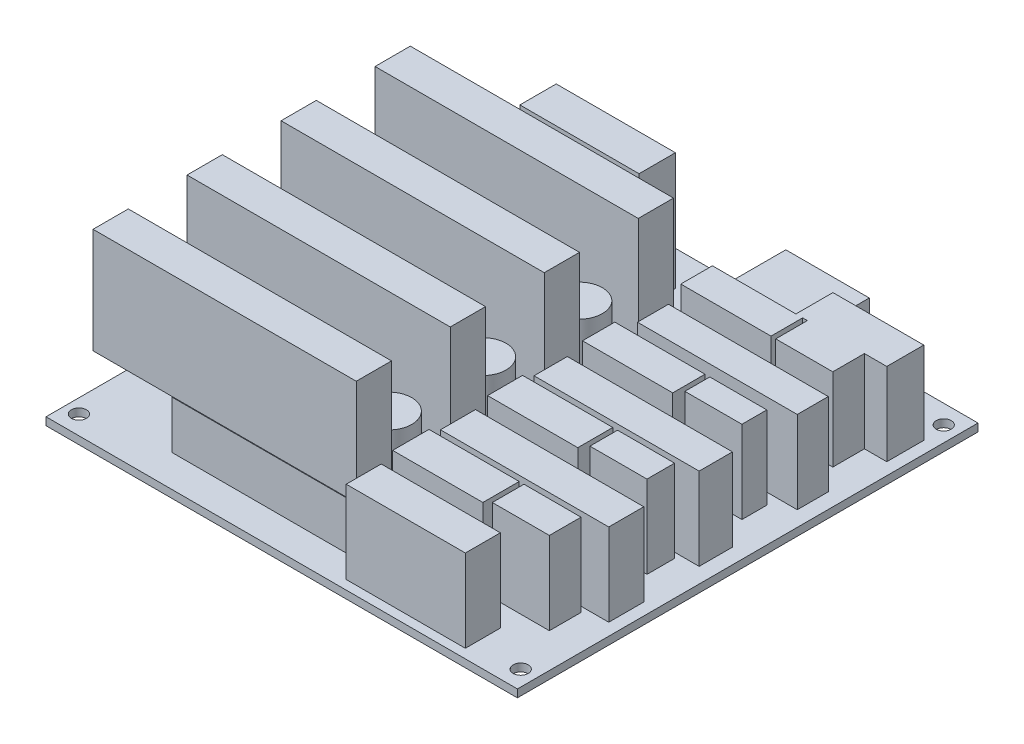
from build123d import *

# Parameters (mm, degrees)
SKETCH2_W            = 100.3
SKETCH2_H            = 98
BOSS_EXTRUDE1_DEPTH  = 1.65
SKETCH5_W            = 39.102680246
SKETCH5_H            = 7.304896309
SKETCH5_H_2          = 7.877829353
SKETCH5_H_3          = 8.164295876
SKETCH5_H_4          = 7.448129571
BOSS_EXTRUDE4_DEPTH  = 10.2
SKETCH5_3_R          = 4.932717276
BOSS_EXTRUDE5_DEPTH  = 17.65
M3_CLEARANCE_HOLE1_D = 3.2
SKETCH6_W            = 56
SKETCH6_H            = 7.5
BOSS_EXTRUDE6_DEPTH  = 22.4
LPATTERN1_COUNT      = 4
LPATTERN1_PITCH      = 20
SKETCH5_4_W          = 25.352287192
SKETCH5_4_H          = 7.44812957
SKETCH5_4_W_2        = 19.193256971
SKETCH5_4_H_2        = 7.734596093
SKETCH5_4_W_3        = 35.808315243
SKETCH5_4_W_4        = 35.131761676
SKETCH5_4_H_3        = 7.085146118
SKETCH5_4_H_4        = 6.875196527
SKETCH5_4_W_5        = 34.004867694
SKETCH5_4_H_5        = 6.601011751
SKETCH5_4_W_6        = 12.138008325
SKETCH5_4_H_6        = 5.299630656
SKETCH5_4_H_7        = 5.8725637
SKETCH5_4_H_8        = 6.731963266
BOSS_EXTRUDE11_DEPTH = 17.56
SKETCH5_6_W          = 17.760924361
SKETCH5_6_H          = 13.893626315
BOSS_EXTRUDE13_DEPTH = 12.7
SKETCH5_7_W          = 25.352287192
SKETCH5_7_H          = 7.734596093
BOSS_EXTRUDE14_DEPTH = 25


with BuildPart() as part:
    # Sketch2 → Boss-Extrude1 (new body)
    with BuildSketch(Plane(origin=(0, 0, 0), x_dir=(1, 0, 0), z_dir=(0, 1, 0))):
        Rectangle(SKETCH2_W, SKETCH2_H)
    extrude(amount=BOSS_EXTRUDE1_DEPTH)

    # Sketch5 → Boss-Extrude4 (add)
    with BuildSketch(Plane(origin=(0, 1.65, 0), x_dir=(1, 0, 0), z_dir=(0, 1, 0))):
        with Locations((-10.643944628, -38.524846902)):
            Rectangle(SKETCH5_W, SKETCH5_H)
        with Locations((-10.643944628, -18.042490583)):
            Rectangle(SKETCH5_W, SKETCH5_H_2)
        with Locations((-10.643944628, 2.010165954)):
            Rectangle(SKETCH5_W, SKETCH5_H_3)
        with Locations((-10.643944628, 21.704739338)):
            Rectangle(SKETCH5_W, SKETCH5_H_4)
    extrude(amount=BOSS_EXTRUDE4_DEPTH)

    # Sketch5<3> → Boss-Extrude5 (add)
    with BuildSketch(Plane(origin=(0, 1.65, 0), x_dir=(1, 0, 0), z_dir=(0, 1, 0))):
        with Locations((-7.9941293, 11.391944548)):
            Circle(SKETCH5_3_R)
        with BuildLine():
            ThreePointArc((-0.667240619, 7.976338656), (6.236323108, 8.047219973), (6.307204425, 14.9507837))
            ThreePointArc((6.307204425, 14.9507837), (-0.596359302, 14.879902383), (-0.667240619, 7.976338656))
        make_face()
        with Locations((-7.9941293, -9.090411772)):
            Circle(SKETCH5_3_R)
        with Locations((2.891598534, -9.090411772)):
            Circle(SKETCH5_3_R)
        with Locations((-7.9941293, -29.143068308)):
            Circle(SKETCH5_3_R)
        with Locations((2.891598534, -29.143068308)):
            Circle(SKETCH5_3_R)
    extrude(amount=BOSS_EXTRUDE5_DEPTH)

    # M3 Clearance Hole1 (through all)
    with Locations(Plane(origin=(0, 1.65, 0), x_dir=(1, 0, 0), z_dir=(0, 1, 0))):
        with Locations((46.85, -45), (46.85, 45), (-47.15, 45), (-47.15, -45)):
            Hole(M3_CLEARANCE_HOLE1_D / 2)

    # Sketch6 → Boss-Extrude6 (add)
    with BuildSketch(Plane(origin=(0, 11.85, 0), x_dir=(1, 0, 0), z_dir=(0, 1, 0))):
        with Locations((-19.092604505, 21.704739338)):
            Rectangle(SKETCH6_W, SKETCH6_H)
    boss_extrude6 = extrude(amount=BOSS_EXTRUDE6_DEPTH)

    # LPattern1: Boss-Extrude6 ×4
    with Locations(*[(0, 0, i * LPATTERN1_PITCH) for i in range(1, LPATTERN1_COUNT)]):
        add(boss_extrude6)

    # Sketch5<4> → Boss-Extrude11 (add)
    with BuildSketch(Plane(origin=(0, 1.65, 0), x_dir=(1, 0, 0), z_dir=(0, 1, 0))):
        with Locations((24.44820431, -43.323161144)):
            Rectangle(SKETCH5_4_W, SKETCH5_4_H)
        with Locations((20.07958985, -32.007733528)):
            Rectangle(SKETCH5_4_W_2, SKETCH5_4_H_2)
        with Locations((29.676218335, -23.270504608)):
            Rectangle(SKETCH5_4_W_3, SKETCH5_4_H)
        with Locations((29.337941552, -3.542573059)):
            Rectangle(SKETCH5_4_W_4, SKETCH5_4_H_3)
        with Locations((20.07958985, 7.954346285)):
            Rectangle(SKETCH5_4_W_2, SKETCH5_4_H_4)
        Polygon((28.243885726, 32.160767389), (10.482961365, 32.160767389), (10.482961365, 25.428804123), (29.676218336, 25.428804123), (29.676218336, 32.160767389), (30.687443267, 32.160767389), (30.687443267, 25.428804123), (42.825451592, 25.428804123), (42.825451592, 32.160767389), (47.580375957, 32.160767389), (47.580375957, 40.038596742), (28.243885726, 40.038596742), align=None)
        with Locations((29.901388543, 17.0913323)):
            Rectangle(SKETCH5_4_W_5, SKETCH5_4_H_5)
        with Locations((20.07958985, -11.955076991)):
            Rectangle(SKETCH5_4_W_2, SKETCH5_4_H)
        with Locations((36.756447429, 8.74212922)):
            Rectangle(SKETCH5_4_W_6, SKETCH5_4_H_6)
        with Locations((36.756447429, -11.167294056)):
            Rectangle(SKETCH5_4_W_6, SKETCH5_4_H_7)
        with Locations((36.756447429, -31.506417114)):
            Rectangle(SKETCH5_4_W_6, SKETCH5_4_H_8)
    extrude(amount=BOSS_EXTRUDE11_DEPTH)

    # Sketch5<6> → Boss-Extrude13 (add)
    with BuildSketch(Plane(origin=(0, 1.65, 0), x_dir=(1, 0, 0), z_dir=(0, 1, 0))):
        with Locations((19.363423546, 40.826379678)):
            Rectangle(SKETCH5_6_W, SKETCH5_6_H)
    extrude(amount=BOSS_EXTRUDE13_DEPTH)

    # Sketch5<7> → Boss-Extrude14 (add)
    with BuildSketch(Plane(origin=(0, 1.65, 0), x_dir=(1, 0, 0), z_dir=(0, 1, 0))):
        with Locations((-19.524406809, 37.746864567)):
            Rectangle(SKETCH5_7_W, SKETCH5_7_H)
    extrude(amount=BOSS_EXTRUDE14_DEPTH)


solid = part.part
